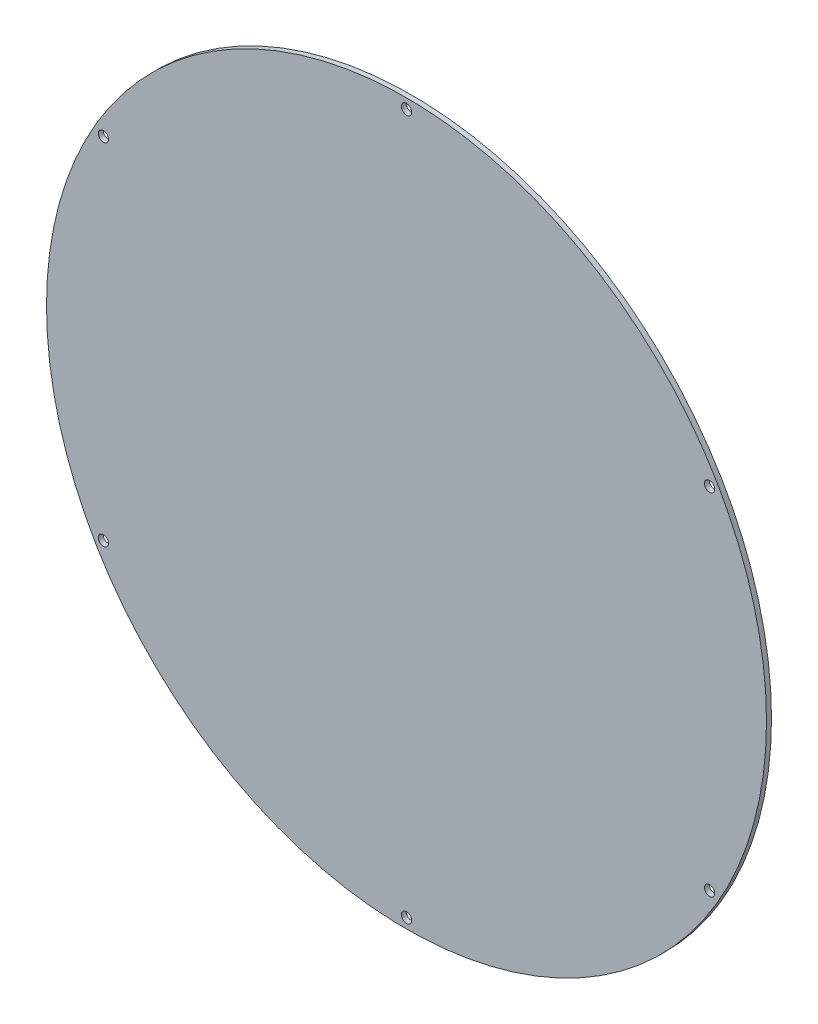
from build123d import *

# Parameters (mm, degrees)
SKETCH1_R             = 114.3
BOSS_EXTRUDE1_DEPTH   = 1.5875
F_4_CLEARANCE_HOLE1_D = 3.2639


with BuildPart() as part:
    # Sketch1 → Boss-Extrude1 (new body)
    with BuildSketch(Plane.XY):
        Circle(SKETCH1_R)
    extrude(amount=BOSS_EXTRUDE1_DEPTH)

    # #4 Clearance Hole1 (through all)
    with Locations(Plane(origin=(0, 111.125, 1.5875), x_dir=(1, 0, 0), z_dir=(0, 0, 1))):
        with Locations((0, 0), (96.237072996, -55.5625), (96.237072996, -166.6875), (0, -222.25), (-96.237072996, -166.6875), (-96.237072996, -55.5625)):
            Hole(F_4_CLEARANCE_HOLE1_D / 2)


solid = part.part
